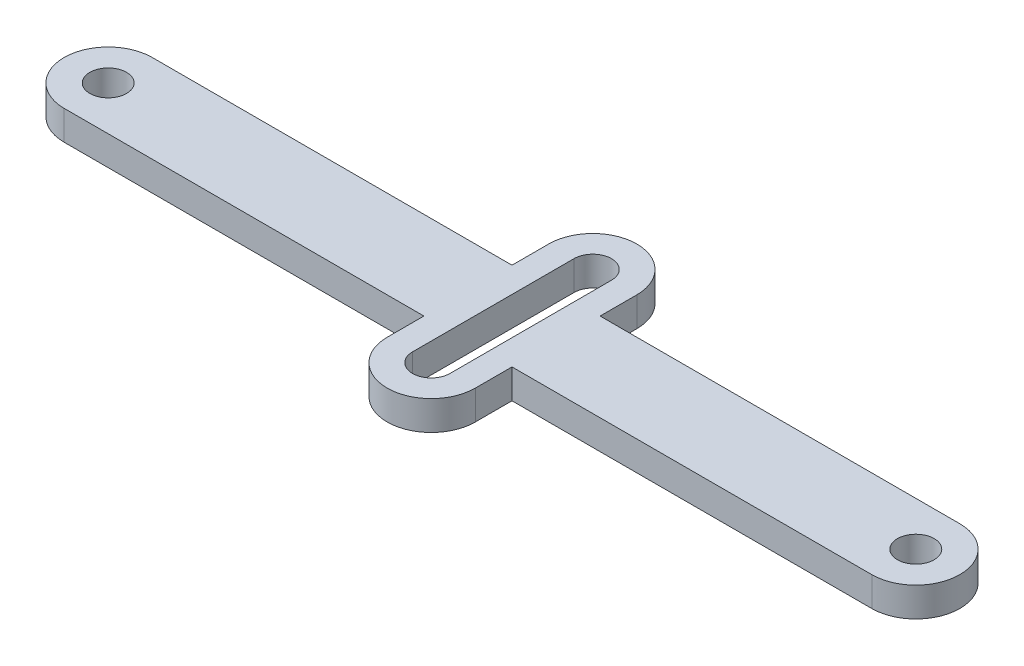
from build123d import *

# Parameters (mm, degrees)
SKETCH_1_R          = 2.5
EXTRUDE_1_DEPTH     = 4
EXTRUDE_2_DEPTH     = 4
CUT_EXTRUDE_1_DEPTH = 5


with BuildPart() as part:
    # 草图1 → 凸台-拉伸1 (new body)
    with BuildSketch(Plane(origin=(0, 0, 0), x_dir=(1, 0, 0), z_dir=(0, 1, 0))):
        with BuildLine():
            Line((-55, 6), (55, 6))
            ThreePointArc((55, 6), (61, 0), (55, -6))
            Line((55, -6), (-55, -6))
            ThreePointArc((-55, -6), (-61, 0), (-55, 6))
        make_face()
        with Locations(Location((55, 0, 0), (0, 0, 270))):
            Circle(SKETCH_1_R, mode=Mode.SUBTRACT)
        with Locations(Location((-55, 0, 0), (0, 0, 270))):
            Circle(SKETCH_1_R, mode=Mode.SUBTRACT)
    extrude(amount=EXTRUDE_1_DEPTH)

    # 草图2 → 凸台-拉伸2 (add)
    with BuildSketch(Plane(origin=(0, 4, 0), x_dir=(1, 0, 0), z_dir=(0, 1, 0))):
        with BuildLine():
            Line((-6, -11), (-6, 11))
            ThreePointArc((-6, 11), (0, 17), (6, 11))
            Line((6, 11), (6, -11))
            ThreePointArc((6, -11), (0, -17), (-6, -11))
        make_face()
    extrude(amount=-EXTRUDE_2_DEPTH)

    # 草图3 → 切除-拉伸1 (cut)
    with BuildSketch(Plane(origin=(0, 4, 0), x_dir=(1, 0, 0), z_dir=(0, 1, 0))):
        with BuildLine():
            Line((-2.55, -11), (-2.55, 11))
            ThreePointArc((-2.55, 11), (0, 13.55), (2.55, 11))
            Line((2.55, 11), (2.55, -11))
            ThreePointArc((2.55, -11), (0, -13.55), (-2.55, -11))
        make_face()
    extrude(amount=-CUT_EXTRUDE_1_DEPTH, mode=Mode.SUBTRACT)


solid = part.part
